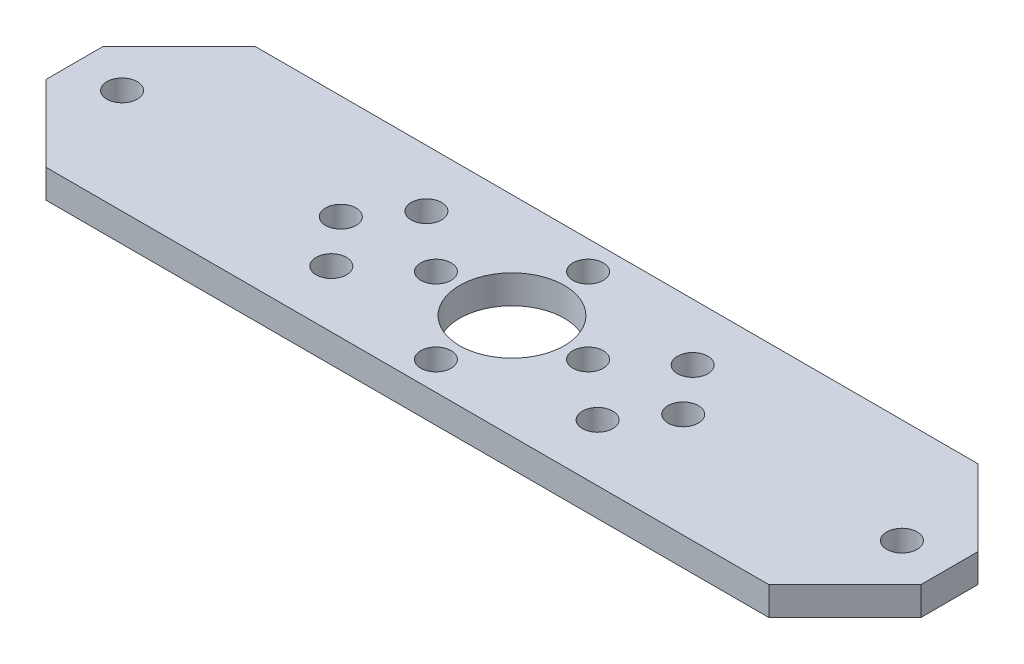
from build123d import *

# Parameters (mm, degrees)
SKETCH_1_R      = 1.6
SKETCH_1_R_2    = 5.5
EXTRUDE_1_DEPTH = 3


with BuildPart() as part:
    # 草图1 → 凸台-拉伸1 (new body)
    with BuildSketch(Plane(origin=(0, 0, 0), x_dir=(1, 0, 0), z_dir=(0, 1, 0))):
        Polygon((-46, 3), (-38, 11), (38, 11), (46, 3), (46, -3), (38, -11), (-38, -11), (-46, -3), align=None)
        with Locations(Location((0, 8, 0), (0, 0, 270))):
            Circle(SKETCH_1_R, mode=Mode.SUBTRACT)
        with Locations(Location((8, 0, 0), (0, 0, 270))):
            Circle(SKETCH_1_R, mode=Mode.SUBTRACT)
        with Locations(Location((-8, 0, 0), (0, 0, 90))):
            Circle(SKETCH_1_R, mode=Mode.SUBTRACT)
        with Locations(Location((0, 0, 0), (0, 0, 270))):
            Circle(SKETCH_1_R_2, mode=Mode.SUBTRACT)
        with Locations(Location((0, -8, 0), (0, 0, 90))):
            Circle(SKETCH_1_R, mode=Mode.SUBTRACT)
        with Locations(Location((-18, 0, 0), (0, 0, 270))):
            Circle(SKETCH_1_R, mode=Mode.SUBTRACT)
        with Locations(Location((-14, 5, 0), (0, 0, 270))):
            Circle(SKETCH_1_R, mode=Mode.SUBTRACT)
        with Locations(Location((-14, -5, 0), (0, 0, 90))):
            Circle(SKETCH_1_R, mode=Mode.SUBTRACT)
        with Locations(Location((14, -5, 0), (0, 0, 270))):
            Circle(SKETCH_1_R, mode=Mode.SUBTRACT)
        with Locations(Location((18, 0, 0), (0, 0, 90))):
            Circle(SKETCH_1_R, mode=Mode.SUBTRACT)
        with Locations(Location((14, 5, 0), (0, 0, 90))):
            Circle(SKETCH_1_R, mode=Mode.SUBTRACT)
        with Locations(Location((-41, 0, 0), (0, 0, 270))):
            Circle(SKETCH_1_R, mode=Mode.SUBTRACT)
        with Locations(Location((41, 0, 0), (0, 0, 90))):
            Circle(SKETCH_1_R, mode=Mode.SUBTRACT)
    extrude(amount=EXTRUDE_1_DEPTH)


solid = part.part
